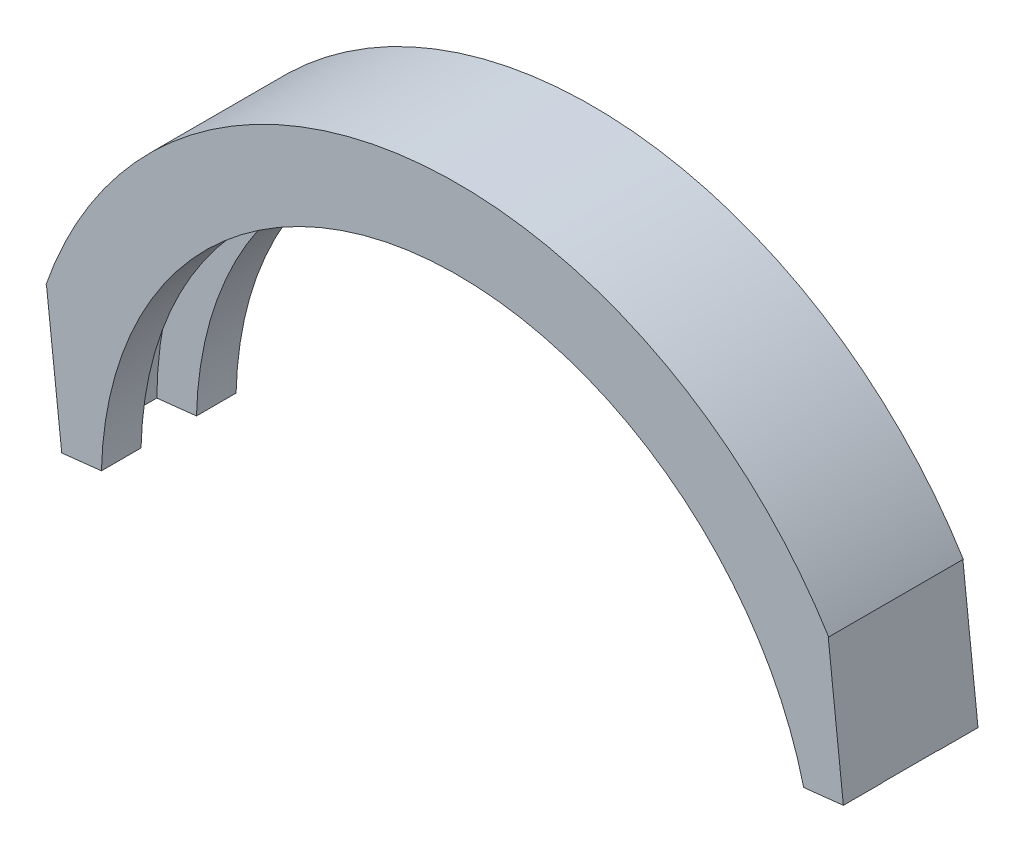
from build123d import *

# Parameters (mm, degrees)
SKETCH1_W                    = 50
SKETCH1_H                    = 7
REVOLVE1_ANGLE               = 167.5
SHELL7_T                     = 5
CUT_EXTRUDE1_DEPTH           = 80.617837197
CUT_EXTRUDE1_DEPTH_BACK      = 10
CUT_EXTRUDE2_DEPTH           = 80.617837197
CUT_EXTRUDE2_DEPTH_BACK      = 10
CUT_EXTRUDE3_DEPTH           = 80.617837197
CUT_EXTRUDE3_DEPTH_BACK      = 10
CUT_EXTRUDE4_DEPTH           = 80.617837197
CUT_EXTRUDE4_DEPTH_BACK      = 10
CUT_EXTRUDE_THIN2_DEPTH      = 80.617837197
CUT_EXTRUDE_THIN2_DEPTH_BACK = 20
CUT_EXTRUDE_THIN3_DEPTH      = 80.617837197
CUT_EXTRUDE_THIN3_DEPTH_BACK = 20


with BuildPart() as part:
    # Sketch1 → Revolve1 (revolve)
    with BuildSketch(Plane(origin=(0, 0, 0), x_dir=(1, 0, 0), z_dir=(0, 1, 0))):
        with Locations((-25, 3.5)):
            Rectangle(SKETCH1_W, SKETCH1_H)
    revolve(axis=Axis((0, 0, 0), (0, 0, -1)), revolution_arc=REVOLVE1_ANGLE)

    # Shell7
    shell7_openings = [part.faces().sort_by_distance(p)[0] for p in [
        (-25, 0, -3.5),
        (24.407400178, 5.410990348, -3.5),
    ]]
    offset(amount=SHELL7_T, openings=shell7_openings, kind=Kind.INTERSECTION)

    # Sketch2 → Cut-Extrude1 (cut, two sides: drawn at the far end of the back side and taken through both)
    with BuildSketch(Plane.XY.offset(5).offset(-CUT_EXTRUDE1_DEPTH_BACK)):
        Polygon((-307.130564413, -27.612787673), (-55, 0), (53.696280392, 11.904178767), (305.826844804, 39.51696644), (361.05242015, -464.744162386), (-251.904989067, -531.873916498), align=None)
    extrude(amount=CUT_EXTRUDE1_DEPTH + CUT_EXTRUDE1_DEPTH_BACK, mode=Mode.SUBTRACT)

    # Sketch4 → Cut-Extrude2 (cut, two sides: drawn at the far end of the back side and taken through both)
    with BuildSketch(Plane(origin=(0, 0, -12), x_dir=(-1, 0, 0), z_dir=(0, 0, -1)).offset(-CUT_EXTRUDE2_DEPTH_BACK)):
        Polygon((-305.826844804, 39.51696644), (-53.696280392, 11.904178767), (55, 0), (307.130564413, -27.612787673), (251.904989067, -531.873916498), (-361.05242015, -464.744162386), align=None)
    extrude(amount=CUT_EXTRUDE2_DEPTH + CUT_EXTRUDE2_DEPTH_BACK, mode=Mode.SUBTRACT)

    # Sketch5 → Cut-Extrude3 (cut, two sides: drawn at the far end of the back side and taken through both)
    with BuildSketch(Plane.XY.offset(5).offset(-CUT_EXTRUDE3_DEPTH_BACK)):
        with BuildLine():
            Line((-50.710864423, -233.723704503), (-44.986635536, 1.096641764))
            ThreePointArc((-44.986635536, 1.096641764), (-4.899009368, 44.73253522), (43.682915928, 10.807537003))
            Line((43.682915928, 10.807537003), (100.095882825, -217.207679557))
            Line((100.095882825, -217.207679557), (151.239386336, -684.19567653))
            Line((151.239386336, -684.19567653), (0.432639088, -700.711701476))
            Line((0.432639088, -700.711701476), (-50.710864423, -233.723704503))
        make_face()
    extrude(amount=CUT_EXTRUDE3_DEPTH + CUT_EXTRUDE3_DEPTH_BACK, mode=Mode.SUBTRACT)

    # Sketch6 → Cut-Extrude4 (cut, two sides: drawn at the far end of the back side and taken through both)
    with BuildSketch(Plane(origin=(0, 0, -12), x_dir=(-1, 0, 0), z_dir=(0, 0, -1)).offset(-CUT_EXTRUDE4_DEPTH_BACK)):
        with BuildLine():
            Line((-100.095882825, -217.207679557), (-43.682915928, 10.807537003))
            ThreePointArc((-43.682915928, 10.807537003), (4.899009368, 44.73253522), (44.986635536, 1.096641764))
            Line((44.986635536, 1.096641764), (50.710864423, -233.723704503))
            Line((50.710864423, -233.723704503), (-0.432639088, -700.711701476))
            Line((-0.432639088, -700.711701476), (-151.239386336, -684.19567653))
            Line((-151.239386336, -684.19567653), (-100.095882825, -217.207679557))
        make_face()
    extrude(amount=CUT_EXTRUDE4_DEPTH + CUT_EXTRUDE4_DEPTH_BACK, mode=Mode.SUBTRACT)

    # Sketch13 → Cut-Extrude-Thin2 (cut, two sides: drawn at the far end of the back side and taken through both)
    with BuildSketch(Plane.XY.offset(5).offset(-CUT_EXTRUDE_THIN2_DEPTH_BACK)):
        Polygon((48.68959816, 11.355857885), (46.775458357, 28.833743654), (56.716021739, 29.922412403), (58.630161542, 12.444526633), align=None)
    extrude(amount=CUT_EXTRUDE_THIN2_DEPTH + CUT_EXTRUDE_THIN2_DEPTH_BACK, mode=Mode.SUBTRACT)

    # Sketch14 → Cut-Extrude-Thin3 (cut, two sides: drawn at the far end of the back side and taken through both)
    with BuildSketch(Plane.XY.offset(5).offset(-CUT_EXTRUDE_THIN3_DEPTH_BACK)):
        Polygon((-49.99699777, 0.547917856), (-51.927891207, 17.96441574), (-61.8669959, 16.862509251), (-59.936102463, -0.553988632), align=None)
    extrude(amount=CUT_EXTRUDE_THIN3_DEPTH + CUT_EXTRUDE_THIN3_DEPTH_BACK, mode=Mode.SUBTRACT)


solid = part.part
